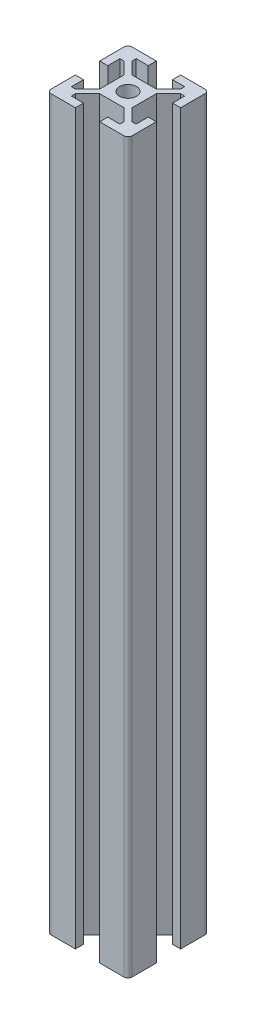
from build123d import *

# Parameters (mm, degrees)
SKETCH1_W           = 8
SKETCH1_H           = 8
SKETCH1_R           = 2.1
BOSS_EXTRUDE1_DEPTH = 180
FILLET1_R           = 1


with BuildPart() as part:
    # Sketch1 → Boss-Extrude1 (new body)
    # profile 1 of 6: a face of its own
    with BuildSketch(Plane(origin=(0, 0, 0), x_dir=(1, 0, 0), z_dir=(0, 1, 0))):
        Polygon((-4, 4), (-10, 10), (-10, 3), (-8, 3), (-8, 6), (-7, 6), (-4, 3), align=None)
    # profile 2 of 6: a face of its own
    with BuildSketch(Plane(origin=(0, 0, 0), x_dir=(1, 0, 0), z_dir=(0, 1, 0))):
        Polygon((-3, 8), (-3, 10), (-10, 10), (-4, 4), (-3, 4), (-6, 7), (-6, 8), align=None)
    # profile 3 of 6: a face of its own
    with BuildSketch(Plane(origin=(0, 0, 0), x_dir=(1, 0, 0), z_dir=(0, 1, 0))):
        Polygon((6, 7), (3, 4), (4, 4), (4, 3), (7, 6), (8, 6), (8, 3), (10, 3), (10, 10), (3, 10), (3, 8), (6, 8), align=None)
    # profile 4 of 6: a face of its own
    with BuildSketch(Plane(origin=(0, 0, 0), x_dir=(1, 0, 0), z_dir=(0, 1, 0))):
        Rectangle(SKETCH1_W, SKETCH1_H)
        with Locations(Location((0, 0, 0), (0, 0, 90))):
            Circle(SKETCH1_R, mode=Mode.SUBTRACT)
    # profile 5 of 6: a face of its own
    with BuildSketch(Plane(origin=(0, 0, 0), x_dir=(1, 0, 0), z_dir=(0, 1, 0))):
        Polygon((4, -4), (3, -4), (6, -7), (6, -8), (3, -8), (3, -10), (10, -10), (10, -3), (8, -3), (8, -6), (7, -6), (4, -3), align=None)
    # profile 6 of 6: a face of its own
    with BuildSketch(Plane(origin=(0, 0, 0), x_dir=(1, 0, 0), z_dir=(0, 1, 0))):
        Polygon((-4, -4), (-4, -3), (-7, -6), (-8, -6), (-8, -3), (-10, -3), (-10, -10), (-3, -10), (-3, -8), (-6, -8), (-6, -7), (-3, -4), align=None)
    extrude(amount=BOSS_EXTRUDE1_DEPTH)

    # Fillet1
    fillet1_edges = [part.edges().sort_by_distance(p)[0] for p in [
        (-10, 90, 10),
        (-10, 90, -10),
        (10, 90, -10),
        (10, 90, 10),
    ]]
    fillet(fillet1_edges, radius=FILLET1_R)


solid = part.part
